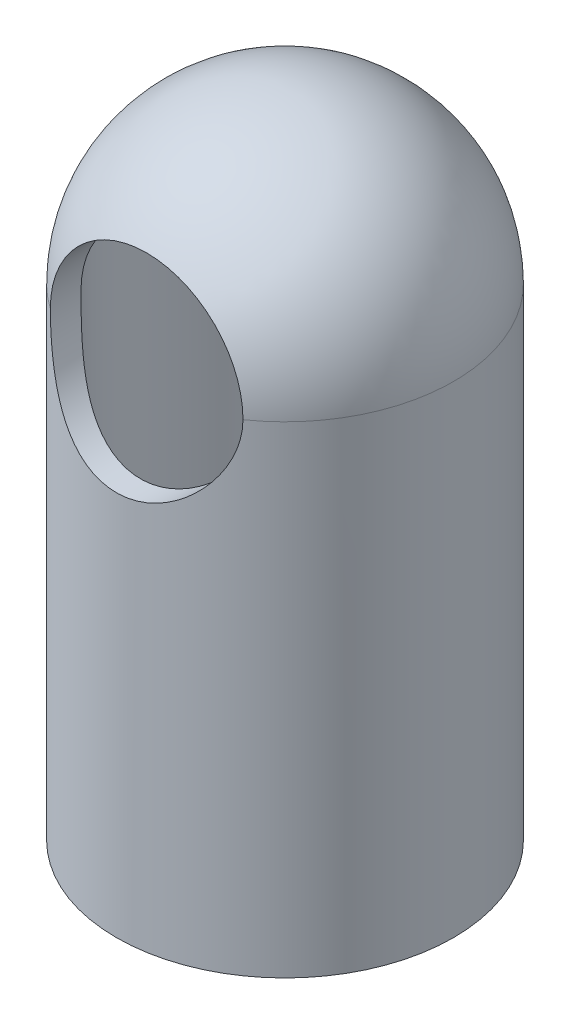
from build123d import *

# Parameters (mm, degrees)
SKETCH_1_R               = 7
SKETCH_1_R_2             = 6
EXTRUDE_1_DEPTH          = 20
CUT_EXTRUDE_1_DEPTH      = 29.757607689
CUT_EXTRUDE_1_DEPTH_BACK = 29.757607689
SKETCH_3_R               = 4


with BuildPart() as part:
    # 草图1 → 凸台-拉伸1 (new body)
    with BuildSketch(Plane(origin=(0, 0, 0), x_dir=(1, 0, 0), z_dir=(0, 1, 0))):
        with Locations(Location((0, 0, 0), (0, 0, 270))):
            Circle(SKETCH_1_R)
        with Locations(Location((0, 0, 0), (0, 0, 270))):
            Circle(SKETCH_1_R_2, mode=Mode.SUBTRACT)
    extrude(amount=EXTRUDE_1_DEPTH)

    # 草图2 → 旋转1 (revolve)
    with BuildSketch(Plane.XY):
        with BuildLine():
            Line((-7, 20), (-6, 20))
            ThreePointArc((-6, 20), (-4.242640687, 24.242640687), (0, 26))
            Line((0, 26), (0, 27))
            ThreePointArc((0, 27), (-4.949747468, 24.949747468), (-7, 20))
        make_face()
    revolve(axis=Axis((0, 20, 0), (0, 1, 0)))

    # 草图3 → 切除-拉伸1 (cut, two sides: drawn at the far end of the back side and taken through both)
    with BuildSketch(Plane.XY.offset(-CUT_EXTRUDE_1_DEPTH_BACK)):
        with Locations((0, 20)):
            Circle(SKETCH_3_R)
    extrude(amount=CUT_EXTRUDE_1_DEPTH + CUT_EXTRUDE_1_DEPTH_BACK, mode=Mode.SUBTRACT)


solid = part.part
